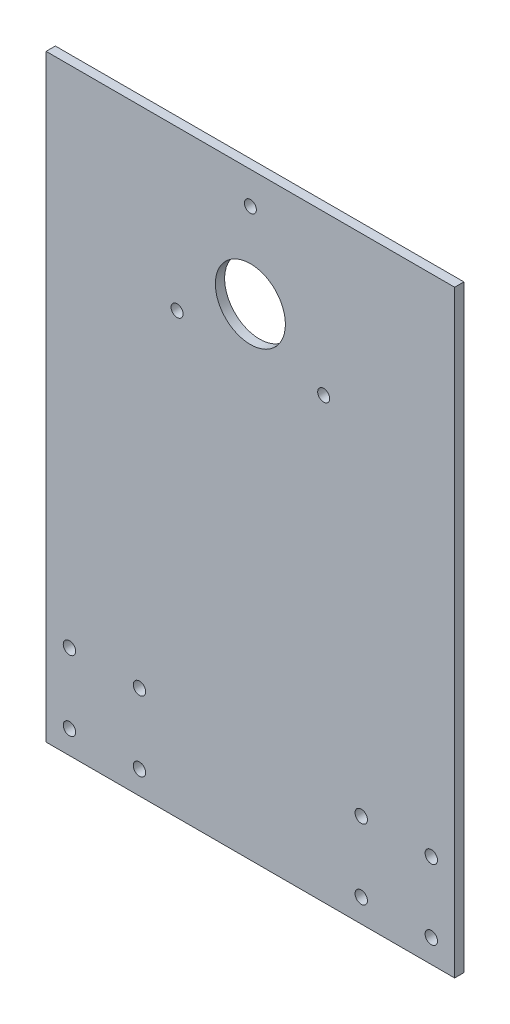
from build123d import *

# Parameters (mm, degrees)
SKETCH1_W           = 140
SKETCH1_H           = 205
SKETCH1_R           = 2.05
SKETCH1_R_2         = 12
SKETCH1_R_3         = 2.125
BOSS_EXTRUDE1_DEPTH = 3.175


with BuildPart() as part:
    # Sketch1 → Boss-Extrude1 (new body)
    with BuildSketch(Plane.XY):
        Rectangle(SKETCH1_W, SKETCH1_H)
        with Locations((0, 91.5)):
            Circle(SKETCH1_R, mode=Mode.SUBTRACT)
        with Locations((25.11473671, 48)):
            Circle(SKETCH1_R, mode=Mode.SUBTRACT)
        with Locations((-25.11473671, 48)):
            Circle(SKETCH1_R, mode=Mode.SUBTRACT)
        with Locations((0, 62.5)):
            Circle(SKETCH1_R_2, mode=Mode.SUBTRACT)
        with Locations((-62, -94.5)):
            Circle(SKETCH1_R_3, mode=Mode.SUBTRACT)
        with Locations(Location((-38, -94.5, 0), (0, 0, 180))):
            Circle(SKETCH1_R_3, mode=Mode.SUBTRACT)
        with Locations((-38, -70.5)):
            Circle(SKETCH1_R_3, mode=Mode.SUBTRACT)
        with Locations(Location((-62, -70.5, 0), (0, 0, 180))):
            Circle(SKETCH1_R_3, mode=Mode.SUBTRACT)
        with Locations((38, -94.5)):
            Circle(SKETCH1_R_3, mode=Mode.SUBTRACT)
        with Locations(Location((62, -94.5, 0), (0, 0, 180))):
            Circle(SKETCH1_R_3, mode=Mode.SUBTRACT)
        with Locations((62, -70.5)):
            Circle(SKETCH1_R_3, mode=Mode.SUBTRACT)
        with Locations(Location((38, -70.5, 0), (0, 0, 180))):
            Circle(SKETCH1_R_3, mode=Mode.SUBTRACT)
    extrude(amount=BOSS_EXTRUDE1_DEPTH)


solid = part.part
